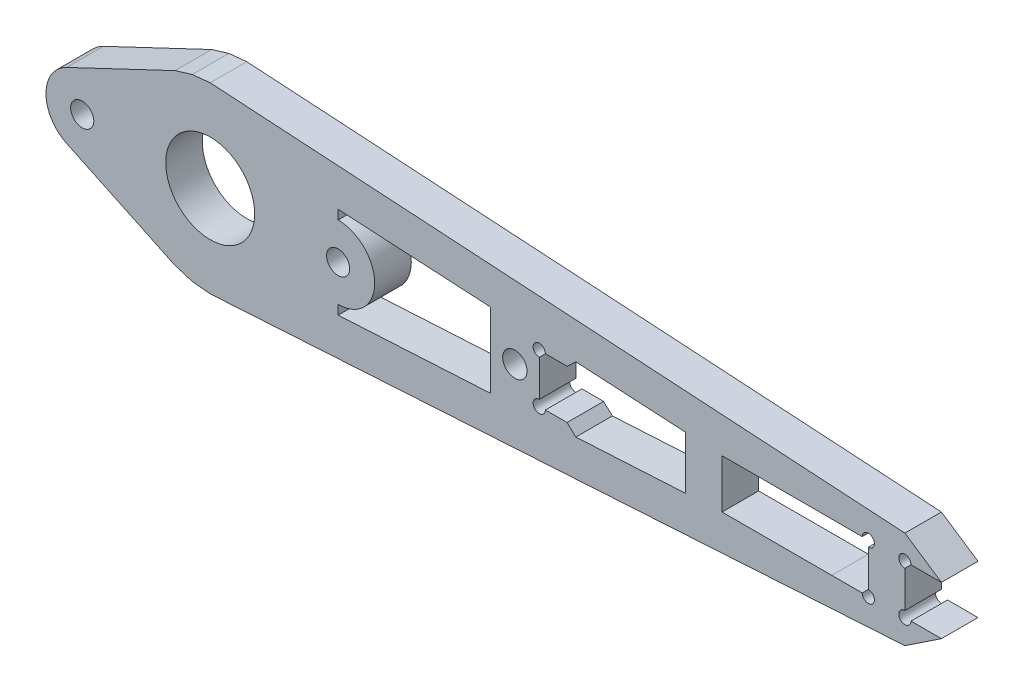
from build123d import *

# Parameters (mm, degrees)
SKETCH_2_R      = 0.999999817
SKETCH_2_R_2    = 0.950000242
SKETCH_2_R_3    = 3.65
EXTRUDE_2_DEPTH = 3


with BuildPart() as part:
    # 草图2 → 凸台-拉伸2 (new body)
    with BuildSketch(Plane.XY):
        with BuildLine():
            Line((57.00000003, 4.00000019), (0, 7.499999832))
            Line((0, 7.499999832), (-1.463177381, 7.355889771))
            Line((-1.463177381, 7.355889771), (-2.870125696, 6.9290963))
            Line((-2.870125696, 6.9290963), (-11.76304094, 2.710484566))
            ThreePointArc((-11.76304094, 2.710484566), (-13.477244136, 0), (-11.76304094, -2.710484566))
            Line((-11.76304094, -2.710484566), (-2.870125696, -6.9290963))
            Line((-2.870125696, -6.9290963), (-1.463177381, -7.355889771))
            Line((-1.463177381, -7.355889771), (0, -7.499999832))
            Line((0, -7.499999832), (57.00000003, -4.00000019))
            Line((57.00000003, -4.00000019), (59.999998659, -2.000000095))
            Line((59.999998659, -2.000000095), (57.500001043, -2.000000095))
            ThreePointArc((57.500001043, -2.000000095), (56.646447675, -2.35355404), (57.00000003, -1.500000013))
            Line((57.00000003, -1.500000013), (57.00000003, 1.500000013))
            ThreePointArc((57.00000003, 1.500000013), (56.646447675, 2.35355404), (57.500001043, 2.000000095))
            Line((57.500001043, 2.000000095), (59.999998659, 2.000000095))
            Line((59.999998659, 2.000000095), (57.00000003, 4.00000019))
        make_face()
        with Locations((25.000000026, 3.041e-06)):
            Circle(SKETCH_2_R, mode=Mode.SUBTRACT)
        with Locations((10.499999852, -1.691e-06)):
            Circle(SKETCH_2_R_2, mode=Mode.SUBTRACT)
        with Locations((-10.499999865, -1.691e-06)):
            Circle(SKETCH_2_R_2, mode=Mode.SUBTRACT)
        Circle(SKETCH_2_R_3, mode=Mode.SUBTRACT)
        with BuildLine():
            Line((41.999999434, 2.002923982), (50.999999046, 2.000000095))
            Line((50.999999046, 2.000000095), (53.500000387, 2.000000095))
            ThreePointArc((53.500000387, 2.000000095), (54.353553756, 2.35355404), (54.000001401, 1.500000013))
            Line((54.000001401, 1.500000013), (54.000001401, -1.500000013))
            ThreePointArc((54.000001401, -1.500000013), (54.353553756, -2.35355404), (53.500000387, -2.000000095))
            Line((53.500000387, -2.000000095), (50.999999046, -2.000000095))
            Line((50.999999046, -2.000000095), (41.999999434, -2.002923982))
            Line((41.999999434, -2.002923982), (41.999999434, 2.002923982))
        make_face(mode=Mode.SUBTRACT)
        with BuildLine():
            Line((27.499999851, 2.000000095), (29.282599688, 2.000000095))
            Line((29.282599688, 2.000000095), (29.999999329, 2.673489275))
            Line((29.999999329, 2.673489275), (39.000000805, 2.170565305))
            Line((39.000000805, 2.170565305), (39.000000805, -2.170565305))
            Line((39.000000805, -2.170565305), (29.999999329, -2.673489275))
            Line((29.999999329, -2.673489275), (29.282599688, -2.000000095))
            Line((29.282599688, -2.000000095), (27.499999851, -2.000000095))
            ThreePointArc((27.499999851, -2.000000095), (26.646446496, -2.353552709), (27.0000007, -1.500000013))
            Line((27.0000007, -1.500000013), (27.0000007, 1.500000013))
            ThreePointArc((27.0000007, 1.500000013), (26.646446496, 2.353552709), (27.499999851, 2.000000095))
        make_face(mode=Mode.SUBTRACT)
        with BuildLine():
            Line((10.499999858, -3.763157874), (10.499999858, -3.000008481))
            ThreePointArc((10.499999858, -3.000008481), (13.500006642, -1.691e-06), (10.499999858, 3.000008481))
            Line((10.499999858, 3.000008481), (10.499999858, 3.763157874))
            Line((10.499999858, 3.763157874), (23.000000045, 3.064652439))
            Line((23.000000045, 3.064652439), (23.000000045, -3.064652439))
            Line((23.000000045, -3.064652439), (10.499999858, -3.763157874))
        make_face(mode=Mode.SUBTRACT)
    extrude(amount=EXTRUDE_2_DEPTH)


solid = part.part
